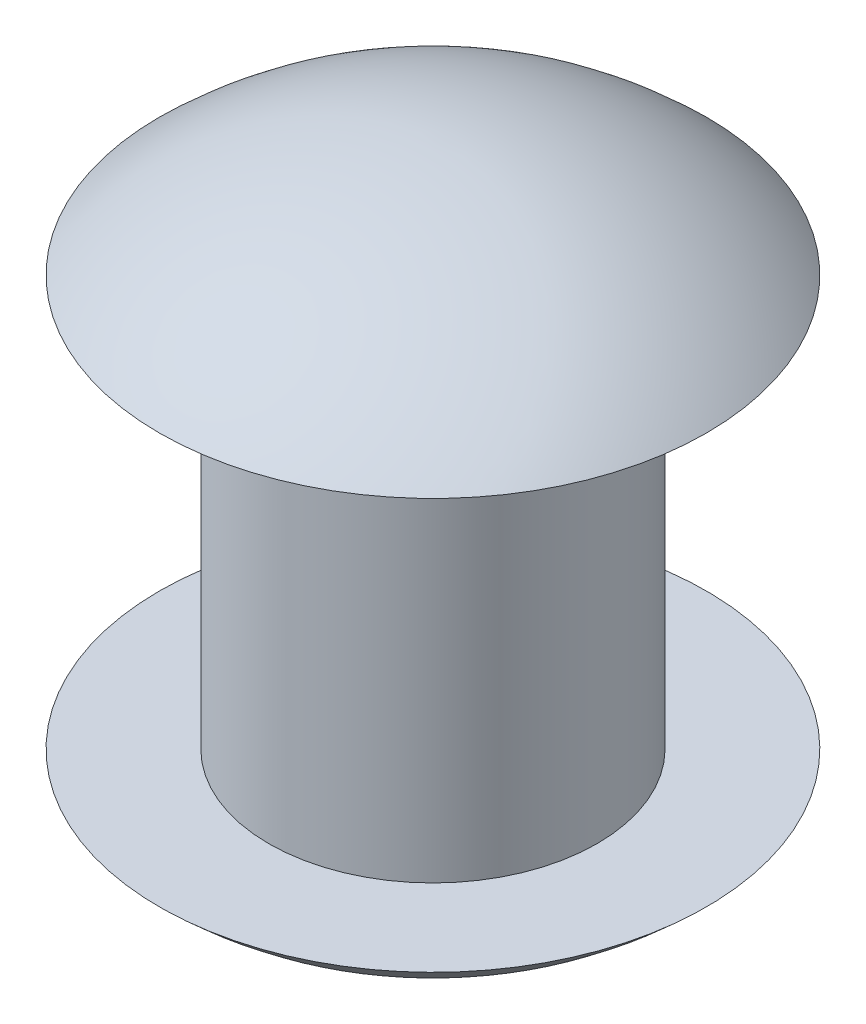
from build123d import *


with BuildPart() as part:
    # Sketch1 → Revolve3 (revolve)
    with BuildSketch(Plane.XY, mode=Mode.PRIVATE) as revolve3_sk:
        with BuildLine():
            Line((0, 5.75), (0, -5.75))
            ThreePointArc((0, -5.75), (2.692582404, -5.231456009), (5, -3.75))
            Line((5, -3.75), (3, -3.75))
            Line((3, -3.75), (3, 3.75))
            Line((3, 3.75), (5, 3.75))
            ThreePointArc((5, 3.75), (2.692582404, 5.231456009), (0, 5.75))
        make_face()
    revolve(revolve3_sk.sketch.rotate(Axis((0, 5.75, 0), (0, -1, 0)), 180), axis=Axis((0, 5.75, 0), (0, -1, 0)))


solid = part.part
